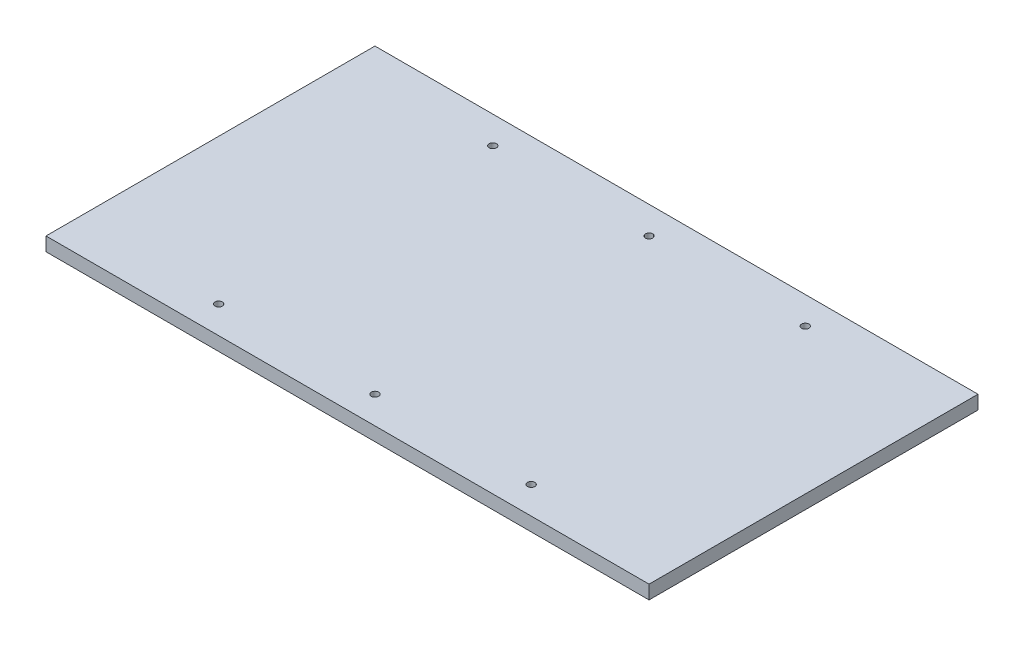
from build123d import *

# Parameters (mm, degrees)
SKETCH1_W           = 279.4
SKETCH1_H           = 152.4
SKETCH1_R           = 1.7
BOSS_EXTRUDE1_DEPTH = 6.35


with BuildPart() as part:
    # Sketch1 → Boss-Extrude1 (new body)
    with BuildSketch(Plane(origin=(0, 0, 0), x_dir=(1, 0, 0), z_dir=(0, 1, 0))):
        Rectangle(SKETCH1_W, SKETCH1_H)
        with Locations(Location((-72.39, 63.5, 0), (0, 0, 270))):
            Circle(SKETCH1_R, mode=Mode.SUBTRACT)
        with Locations(Location((72.39, -63.5, 0), (0, 0, 90))):
            Circle(SKETCH1_R, mode=Mode.SUBTRACT)
        with Locations(Location((0, 63.5, 0), (0, 0, 270))):
            Circle(SKETCH1_R, mode=Mode.SUBTRACT)
        with Locations(Location((72.39, 63.5, 0), (0, 0, 270))):
            Circle(SKETCH1_R, mode=Mode.SUBTRACT)
        with Locations(Location((0, -63.5, 0), (0, 0, 90))):
            Circle(SKETCH1_R, mode=Mode.SUBTRACT)
        with Locations(Location((-72.39, -63.5, 0), (0, 0, 90))):
            Circle(SKETCH1_R, mode=Mode.SUBTRACT)
    extrude(amount=BOSS_EXTRUDE1_DEPTH)


solid = part.part
